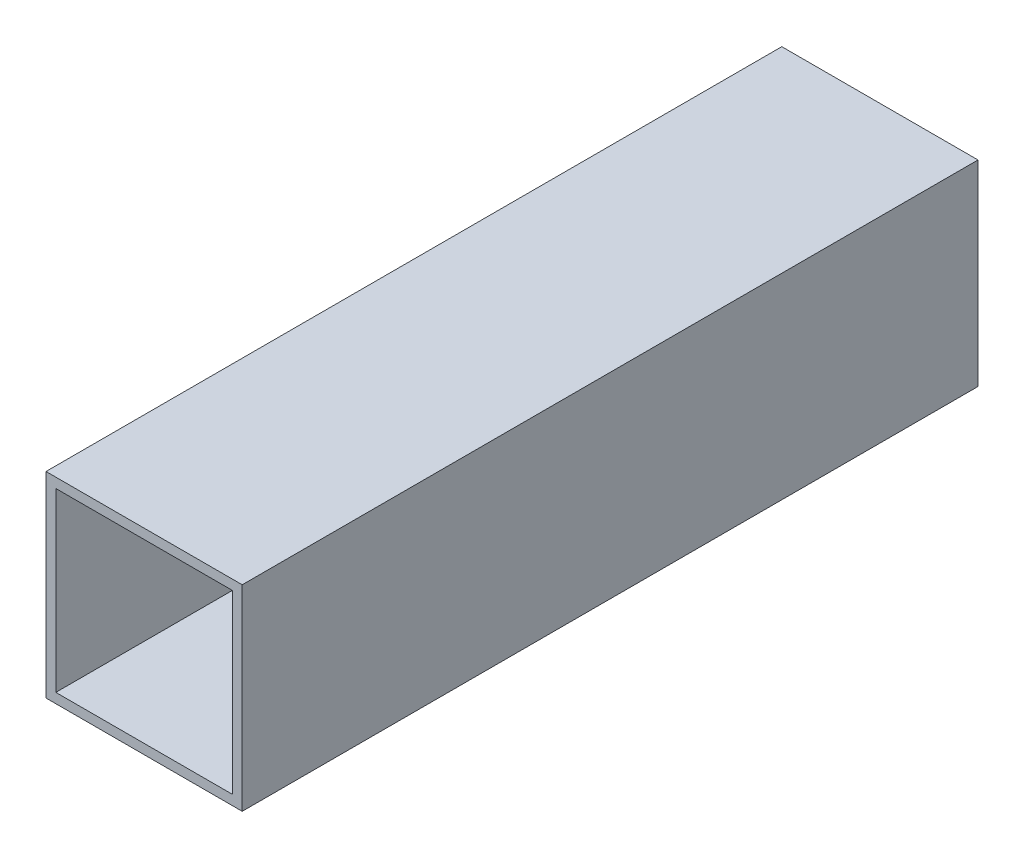
from build123d import *

# Parameters (mm, degrees)
SKETCH_1_W      = 80
SKETCH_1_H      = 80
SKETCH_1_W_2    = 72
SKETCH_1_H_2    = 72
EXTRUDE_1_DEPTH = 300


with BuildPart() as part:
    # Эскиз1 → Бобышка-Вытянуть1 (new body)
    with BuildSketch(Plane.XY):
        Rectangle(SKETCH_1_W, SKETCH_1_H)
        Rectangle(SKETCH_1_W_2, SKETCH_1_H_2, mode=Mode.SUBTRACT)
    extrude(amount=EXTRUDE_1_DEPTH)


solid = part.part
